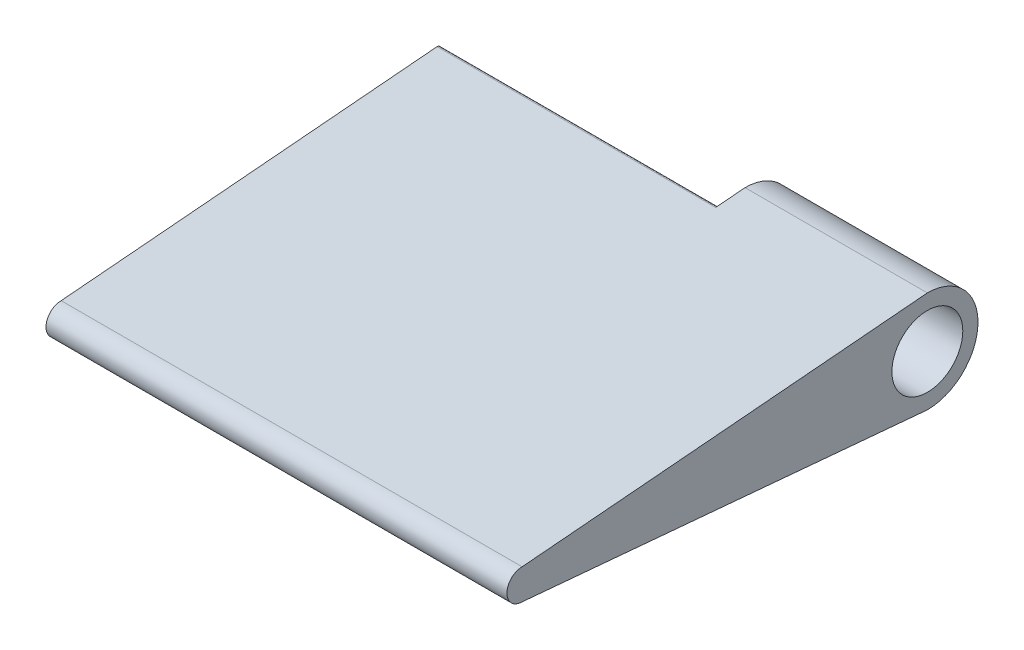
from build123d import *

# Parameters (mm, degrees)
BOSS_EXTRUDE1_DEPTH = 27.5
BOSS_EXTRUDE2_START = 18
SKETCH1_3_R         = 3.5
BOSS_EXTRUDE2_DEPTH = 18
FILLET1_R           = 0.3
CUT_EXTRUDE2_DEPTH  = 48


with BuildPart() as part:
    # Sketch1 → Boss-Extrude1 (new body)
    with BuildSketch(Plane(origin=(0, 0, 0), x_dir=(0, 0, -1), z_dir=(1, 0, 0))):
        with BuildLine():
            Line((-0.8465509939293128, 4.927814060481298), (-40, 1.5891746611200548))
            ThreePointArc((-40, 1.5891746611200588), (-41.50000000000001, 0.08917466112005495), (-40, -1.4108253388799492))
            Line((-40, -1.4108253388799452), (-0.890126933588725, -4.9201294741195705))
            ThreePointArc((-0.8901269335887271, -4.92012947411955), (-4.999951051875788, 0.02212416882480251), (-0.8465509939292982, 4.927814060481311))
        make_face()
    extrude(amount=-BOSS_EXTRUDE1_DEPTH)

    # Sketch1<3> → Boss-Extrude2 (add)
    with BuildSketch(Plane(origin=(0, 0, 0), x_dir=(0, 0, -1), z_dir=(1, 0, 0)).offset(BOSS_EXTRUDE2_START)):
        with BuildLine():
            ThreePointArc((-40, 1.5891746611200588), (-41.50000000000001, 0.08917466112005495), (-40, -1.4108253388799492))
            Line((-40, -1.4108253388799452), (0, -4.999999999999999))
            ThreePointArc((0, -4.999999999999999), (4.999999999999999, -3.1e-16), (6.1e-16, 4.999999999999999))
            Line((0, 5), (-40, 1.5891746611200546))
        make_face()
        Circle(SKETCH1_3_R, mode=Mode.SUBTRACT)
    extrude(amount=-BOSS_EXTRUDE2_DEPTH)

    # Fillet1
    fillet1_edges = [part.edges().sort_by_distance(p)[0] for p in [
        (-13.75, -4.920129474119561, 0.8901269335887261),
        (-13.75, 4.927814060481305, 0.8465509939293054),
    ]]
    fillet(fillet1_edges, radius=FILLET1_R)

    # Sketch2 → Cut-Extrude2 (cut)
    with BuildSketch(Plane.XY):
        Polygon((-27.5, -1.5377558092034955), (-9.500000000000002, -1.5377558092034957), (-9.500000000000002, -6.987023089706997), (-27.5, -6.987023089707), align=None)
    extrude(amount=CUT_EXTRUDE2_DEPTH, mode=Mode.SUBTRACT)


solid = part.part
